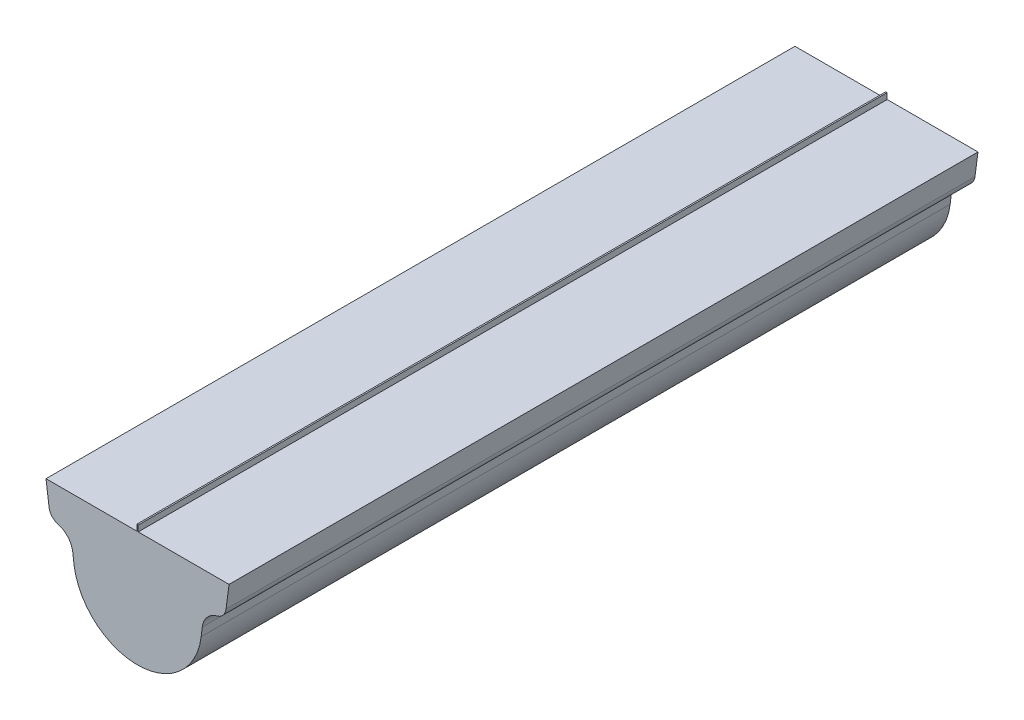
from build123d import *

# Parameters (mm, degrees)
EXTRUDE1_DEPTH = 15
FILLET1_R      = 0.5


with BuildPart() as part:
    # Sketch2 → Extrude1 (new, symmetric)
    with BuildSketch(Plane.XY):
        with BuildLine():
            Line((-2.593415235, 0.045802636), (-2.538323026, -0.401884053))
            ThreePointArc((-2.538323026, -0.401884053), (0.045183933, -2.569603849), (2.550988586, -0.312512721))
            Line((2.550988586, -0.312512721), (2.594832844, 0.045372131))
            ThreePointArc((2.594832844, 0.045372131), (2.899006177, 0.58055361), (3.493240793, 0.741257846))
            Line((3.493240793, 0.741257846), (3.666713736, 2.059896211))
            Line((3.666713736, 2.059896211), (0.028937175, 2.059896211))
            Line((0.028937175, 2.059896211), (0.028937175, 2.258712577))
            Line((0.028937175, 2.258712577), (0.028937175, 2.299985842))
            Line((0.028937175, 2.299985842), (-0.027466707, 2.299985842))
            Line((-0.027466707, 2.299985842), (-0.027466707, 2.258712577))
            Line((-0.027466707, 2.258712577), (-0.027466707, 2.059896211))
            Line((-0.027466707, 2.059896211), (-3.665243268, 2.059896211))
            Line((-3.665243268, 2.059896211), (-3.491770325, 0.741257846))
            ThreePointArc((-3.491770325, 0.741257846), (-2.897707177, 0.580686389), (-2.593415235, 0.045802636))
        make_face()
    extrude(amount=EXTRUDE1_DEPTH, both=True)

    # Fillet1
    fillet1_edges = [part.edges().sort_by_distance(p)[0] for p in [
        (-3.491770325, 0.741257846, 0),
        (3.493240793, 0.741257846, 0),
    ]]
    fillet(fillet1_edges, radius=FILLET1_R)


solid = part.part
